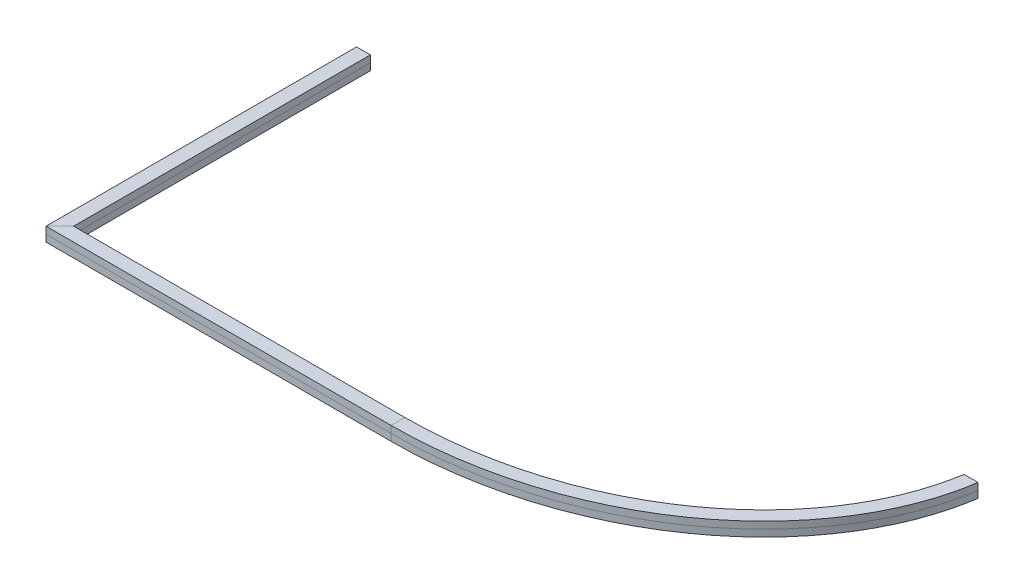
from build123d import *

# Parameters (mm, degrees)
SKETCH3_W           = 6
SKETCH3_H           = 6
SKETCH6_W           = 6
SKETCH6_H           = 6
BOSS_EXTRUDE2_DEPTH = 15
SKETCH13_W          = 20.070411903
SKETCH13_H          = 20.135813936
CUT_EXTRUDE1_DEPTH  = 247.321355287


with BuildPart() as part:
    # Sweep2: sweep along a path in Sketch2
    with BuildLine() as sweep2_path:  # in the path sketch's own coordinates; laid on its plane below (add() does not lay a ready-made edge on the line's plane)
        Line((79, -79), (79, -199))
        Line((79, -199), (-71, -199))
        add(Edge.make_bspline(
            [(-71, -199), (-221, -199), (-221, -79)],
            knots=[0, 0, 0, 1.570796327, 1.570796327, 1.570796327], degree=2, weights=[1, 0.707106781, 1]))
    # Sketch3 → Sweep2 (sweep)
    with BuildSketch(Plane.XY.offset(79)):
        with Locations((-76, 21)):
            Rectangle(SKETCH3_W, SKETCH3_H)
    sweep(path=Plane(origin=(0, 21, 0), x_dir=(-1, 0, 0), z_dir=(0, -1, 0)) * sweep2_path.line, transition=Transition.RIGHT)

    # Sketch6 → Boss-Extrude2 (add)
    with BuildSketch(Plane.XY.offset(79)):
        with Locations((-76, 21)):
            Rectangle(SKETCH6_W, SKETCH6_H)
    extrude(amount=-BOSS_EXTRUDE2_DEPTH)

    # Sketch13 → Cut-Extrude1 (cut, through all)
    with BuildSketch(Plane.XY.offset(92.9)):
        with Locations((216.107136564, 22.218494932)):
            Rectangle(SKETCH13_W, SKETCH13_H)
    extrude(amount=-CUT_EXTRUDE1_DEPTH, mode=Mode.SUBTRACT)


with BuildPart() as body_2:
    # Split1: the piece on the far side of the plane
    add(part.part)
    split(bisect_by=Plane(origin=(0, 21, 0), x_dir=(0, 0, -1), z_dir=(0, -1, 0)), keep=Keep.BOTTOM)


with BuildPart() as part_1:
    add(part.part)

    # Split1
    split(bisect_by=Plane(origin=(0, 21, 0), x_dir=(0, 0, -1), z_dir=(0, -1, 0)), keep=Keep.TOP)


solid = Compound([body_2.part, part_1.part])
